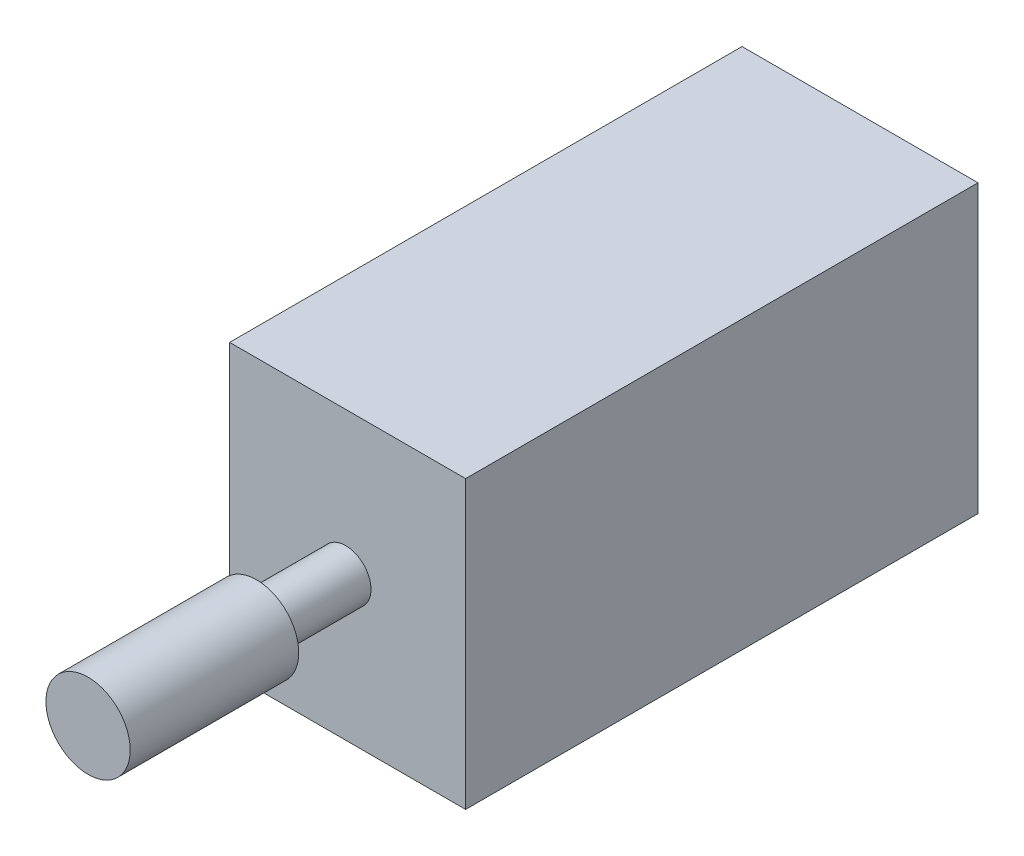
from build123d import *

# Parameters (mm, degrees)
SKETCH1_W           = 30.4
SKETCH1_H           = 17
BOSS_EXTRUDE1_DEPTH = 14
SKETCH2_R           = 1.5
BOSS_EXTRUDE2_DEPTH = 5.4
SKETCH3_R           = 2.5
BOSS_EXTRUDE3_DEPTH = 10


with BuildPart() as part:
    # Sketch1 → Boss-Extrude1 (new body)
    with BuildSketch(Plane(origin=(0, 0, 0), x_dir=(0, 0, -1), z_dir=(1, 0, 0))):
        Rectangle(SKETCH1_W, SKETCH1_H)
    extrude(amount=BOSS_EXTRUDE1_DEPTH)

    # Sketch2 → Boss-Extrude2 (add)
    with BuildSketch(Plane.XY.offset(15.2)):
        with Locations(Location((6.88711981, 0, 0), (0, 0, 180))):
            Circle(SKETCH2_R)
    extrude(amount=BOSS_EXTRUDE2_DEPTH)

    # Sketch3 → Boss-Extrude3 (add)
    with BuildSketch(Plane.XY.offset(20.6)):
        with Locations((7, 0)):
            Circle(SKETCH3_R)
    extrude(amount=BOSS_EXTRUDE3_DEPTH)


solid = part.part
